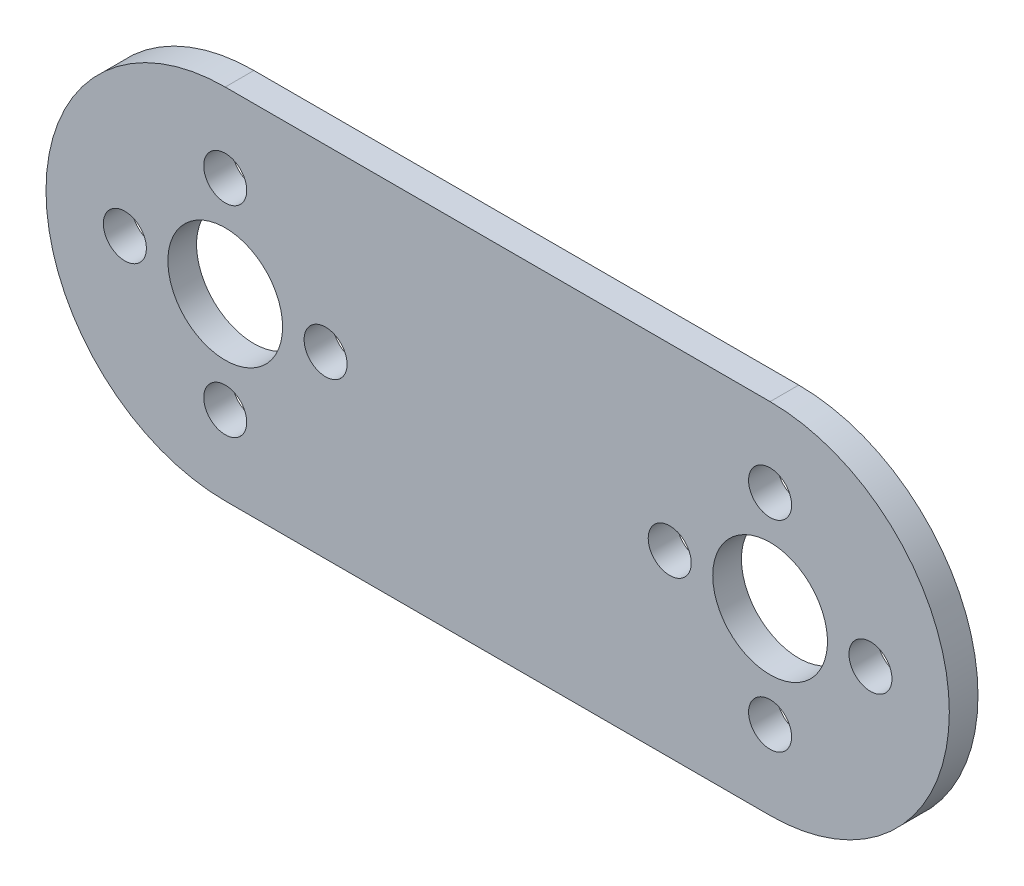
from build123d import *

# Parameters (mm, degrees)
SKETCH_1_R      = 4
SKETCH_1_R_2    = 1.5
EXTRUDE_1_DEPTH = 2


with BuildPart() as part:
    # 草图1 → 凸台-拉伸1 (new body)
    with BuildSketch(Plane.XY):
        with BuildLine():
            Line((0, 12.5), (38, 12.5))
            ThreePointArc((38, 12.5), (50.5, 0), (38, -12.5))
            Line((38, -12.5), (0, -12.5))
            ThreePointArc((0, -12.5), (-12.5, 0), (0, 12.5))
        make_face()
        Circle(SKETCH_1_R, mode=Mode.SUBTRACT)
        with Locations((0, 7)):
            Circle(SKETCH_1_R_2, mode=Mode.SUBTRACT)
        with Locations((7, 0)):
            Circle(SKETCH_1_R_2, mode=Mode.SUBTRACT)
        with Locations((0, -7)):
            Circle(SKETCH_1_R_2, mode=Mode.SUBTRACT)
        with Locations((-7, 0)):
            Circle(SKETCH_1_R_2, mode=Mode.SUBTRACT)
        with Locations(Location((45, 0, 0), (0, 0, 180))):
            Circle(SKETCH_1_R_2, mode=Mode.SUBTRACT)
        with Locations(Location((38, -7, 0), (0, 0, 180))):
            Circle(SKETCH_1_R_2, mode=Mode.SUBTRACT)
        with Locations(Location((31, 0, 0), (0, 0, 180))):
            Circle(SKETCH_1_R_2, mode=Mode.SUBTRACT)
        with Locations(Location((38, 7, 0), (0, 0, 180))):
            Circle(SKETCH_1_R_2, mode=Mode.SUBTRACT)
        with Locations(Location((38, 0, 0), (0, 0, 180))):
            Circle(SKETCH_1_R, mode=Mode.SUBTRACT)
    extrude(amount=EXTRUDE_1_DEPTH)


solid = part.part
